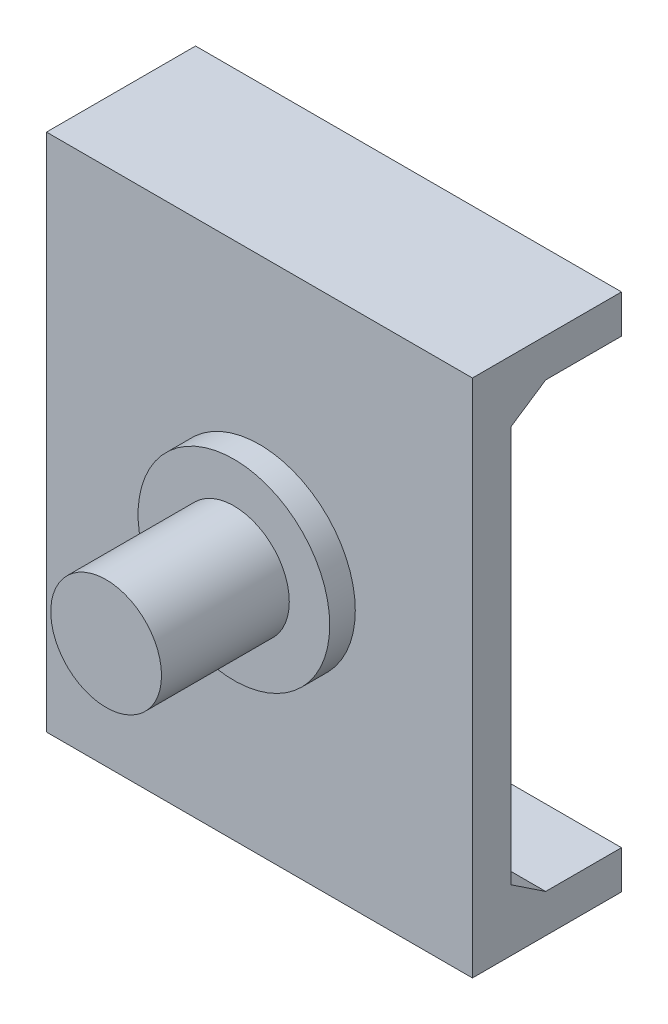
from build123d import *

# Parameters (mm, degrees)
BOSS_EXTRUDE1_DEPTH      = 2
BOSS_EXTRUDE1_DEPTH_BACK = 5
SKETCH1_W                = 20
SKETCH1_H                = 24.4
CUT_EXTRUDE1_DEPTH       = 24.954957733
SKETCH4_R                = 4.5
BOSS_EXTRUDE2_DEPTH      = 1.2
SKETCH5_R                = 2.6
BOSS_EXTRUDE3_DEPTH      = 6


with BuildPart() as part:
    # Sketch1 → Boss-Extrude1 (new, two sides: drawn at the far end of the back side and taken through both)
    with BuildSketch(Plane.XY.offset(-BOSS_EXTRUDE1_DEPTH_BACK)):
        Rectangle(SKETCH1_W, SKETCH1_H)
    extrude(amount=BOSS_EXTRUDE1_DEPTH + BOSS_EXTRUDE1_DEPTH_BACK)

    # Sketch3 → Cut-Extrude1 (cut, through all)
    with BuildSketch(Plane(origin=(10, 0, 0), x_dir=(0, 0, -1), z_dir=(1, 0, 0))):
        Polygon((8.2, -10.4), (1.439444872, -10.4), (-0.2, -9.307036752), (-0.2, -7.95), (-0.2, -5.45), (-0.2, 5.45), (-0.2, 7.95), (-0.2, 9.307036752), (1.439444872, 10.4), (8.2, 10.4), align=None)
    extrude(amount=-CUT_EXTRUDE1_DEPTH, mode=Mode.SUBTRACT)

    # Sketch4 → Boss-Extrude2 (add)
    with BuildSketch(Plane.XY.offset(2)):
        Circle(SKETCH4_R)
    extrude(amount=BOSS_EXTRUDE2_DEPTH)

    # Sketch5 → Boss-Extrude3 (add)
    with BuildSketch(Plane.XY.offset(3.2)):
        Circle(SKETCH5_R)
    extrude(amount=BOSS_EXTRUDE3_DEPTH)


solid = part.part
